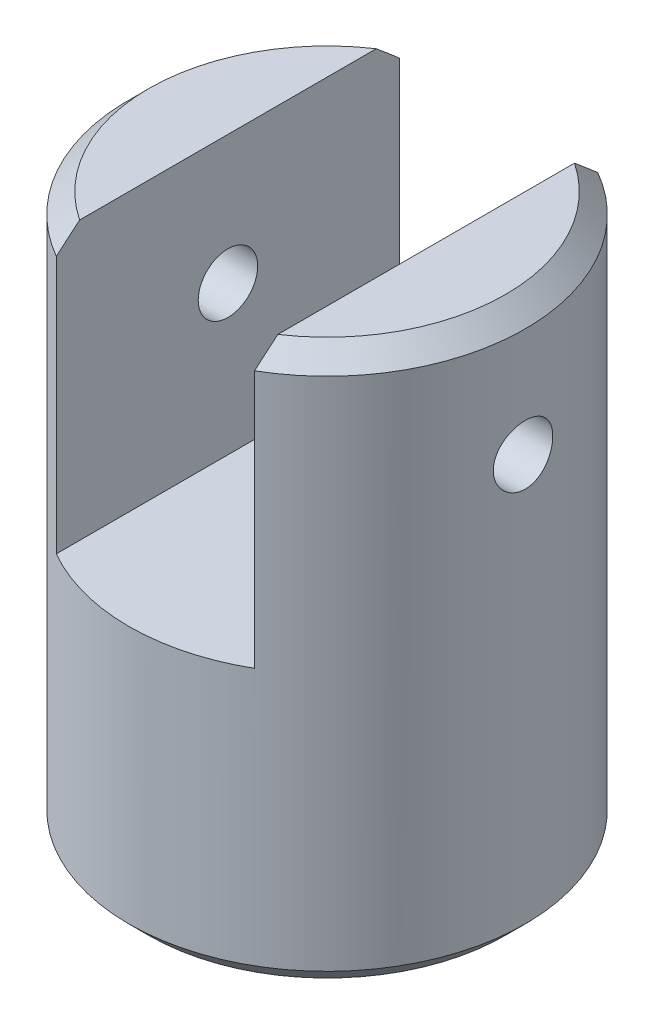
from build123d import *

# Parameters (mm, degrees)
SKETCH1_R                      = 5
BOSS_EXTRUDE1_DEPTH            = 14
CHAMFER1_SIZE                  = 0.5
CUT_EXTRUDE1_REACH             = 17.684
SKETCH2_R                      = 0.75
SKETCH3_W                      = 5
SKETCH3_H                      = 10
CUT_EXTRUDE2_DEPTH             = 7
CUT_EXTRUDE3_REACH             = 17.684
SKETCH4_R                      = 0.75
CUT_EXTRUDE3_DIRECTION_2_REACH = 17.684


with BuildPart() as part:
    # Sketch1 → Boss-Extrude1 (new body)
    with BuildSketch(Plane(origin=(0, 0, 0), x_dir=(1, 0, 0), z_dir=(0, 1, 0))):
        with Locations(Location((0, 0, 0), (0, 0, 270))):
            Circle(SKETCH1_R)
    extrude(amount=BOSS_EXTRUDE1_DEPTH)

    # Chamfer1
    chamfer1_edges = [part.edges().sort_by_distance(p)[0] for p in [
        (0, 0, -5),
        (0, 14, -5),
    ]]
    chamfer(chamfer1_edges, length=CHAMFER1_SIZE)

    # Sketch2 → Cut-Extrude1 (cut, up to next)
    with BuildSketch(Plane.XZ, mode=Mode.PRIVATE) as cut_extrude1_sk1:
        with Locations(Location((0, 0, 0), (0, 0, 270))):
            Circle(SKETCH2_R)
    cut_extrude1_tool1 = extrude(cut_extrude1_sk1.sketch, amount=-CUT_EXTRUDE1_REACH, mode=Mode.PRIVATE) & part.part
    add(cut_extrude1_tool1.solids().sort_by_distance((0, 0, 0))[0], mode=Mode.SUBTRACT)

    # Sketch3 → Cut-Extrude2 (cut)
    with BuildSketch(Plane(origin=(0, 14, 0), x_dir=(1, 0, 0), z_dir=(0, 1, 0))):
        Rectangle(SKETCH3_W, SKETCH3_H)
    extrude(amount=-CUT_EXTRUDE2_DEPTH, mode=Mode.SUBTRACT)

    # Sketch4 → Cut-Extrude3 (cut, up to next)
    with BuildSketch(Plane(origin=(0, 0, 0), x_dir=(0, 0, -1), z_dir=(1, 0, 0)), mode=Mode.PRIVATE) as cut_extrude3_sk1:
        with Locations(Location((0, 10.75, 0), (0, 0, 180))):
            Circle(SKETCH4_R)
    cut_extrude3_tool1 = extrude(cut_extrude3_sk1.sketch, amount=-CUT_EXTRUDE3_REACH, mode=Mode.PRIVATE) & part.part
    add(cut_extrude3_tool1.solids().sort_by_distance((0, 10.75, 0))[0], mode=Mode.SUBTRACT)

    # Sketch4 → Cut-Extrude3 direction 2 (cut, up to next)
    with BuildSketch(Plane(origin=(0, 0, 0), x_dir=(0, 0, -1), z_dir=(1, 0, 0)), mode=Mode.PRIVATE) as cut_extrude3_direction_2_sk1:
        with Locations(Location((0, 10.75, 0), (0, 0, 180))):
            Circle(SKETCH4_R)
    cut_extrude3_direction_2_tool1 = extrude(cut_extrude3_direction_2_sk1.sketch, amount=CUT_EXTRUDE3_DIRECTION_2_REACH, mode=Mode.PRIVATE) & part.part
    add(cut_extrude3_direction_2_tool1.solids().sort_by_distance((0, 10.75, 0))[0], mode=Mode.SUBTRACT)


solid = part.part
